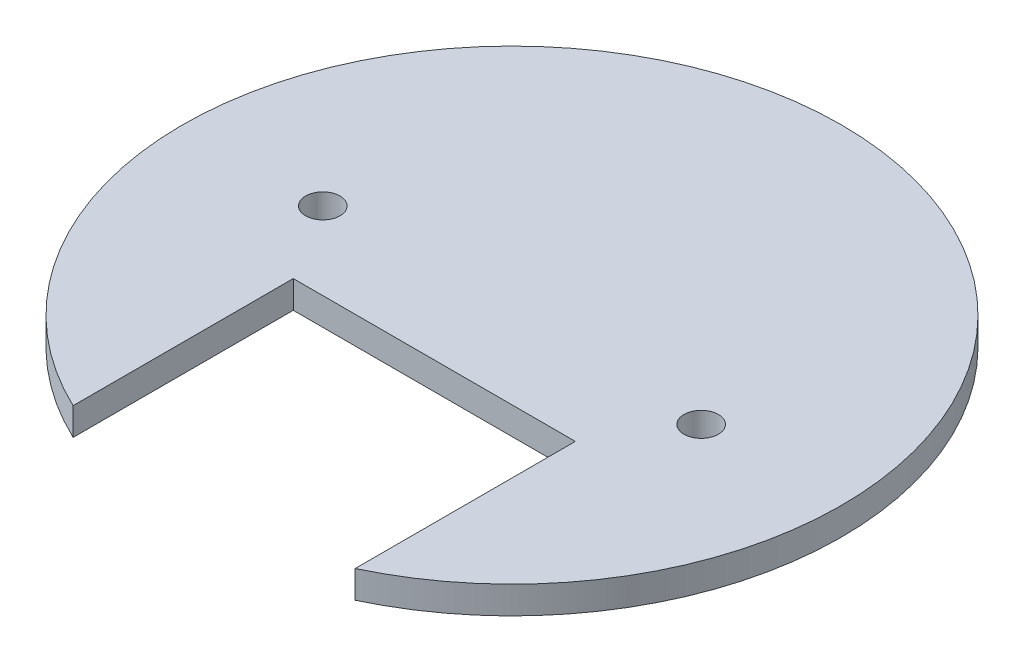
from build123d import *

# Parameters (mm, degrees)
SKETCH1_R           = 2.5
BOSS_EXTRUDE2_DEPTH = 4


with BuildPart() as part:
    # Sketch1 → Boss-Extrude2 (new body)
    with BuildSketch(Plane(origin=(0, 0, 0), x_dir=(1, 0, 0), z_dir=(0, 1, 0))):
        with BuildLine():
            Line((-20.5, -43.291569618), (-20.5, -11.291569618))
            Line((-20.5, -11.291569618), (20.5, -11.291569618))
            Line((20.5, -11.291569618), (20.5, -43.291569618))
            ThreePointArc((20.5, -43.291569618), (0, 47.9), (-20.5, -43.291569618))
        make_face()
        with Locations(Location((-27.5, 0, 0), (0, 0, 270))):
            Circle(SKETCH1_R, mode=Mode.SUBTRACT)
        with Locations(Location((27.5, 0, 0), (0, 0, 90))):
            Circle(SKETCH1_R, mode=Mode.SUBTRACT)
    extrude(amount=BOSS_EXTRUDE2_DEPTH)


solid = part.part
